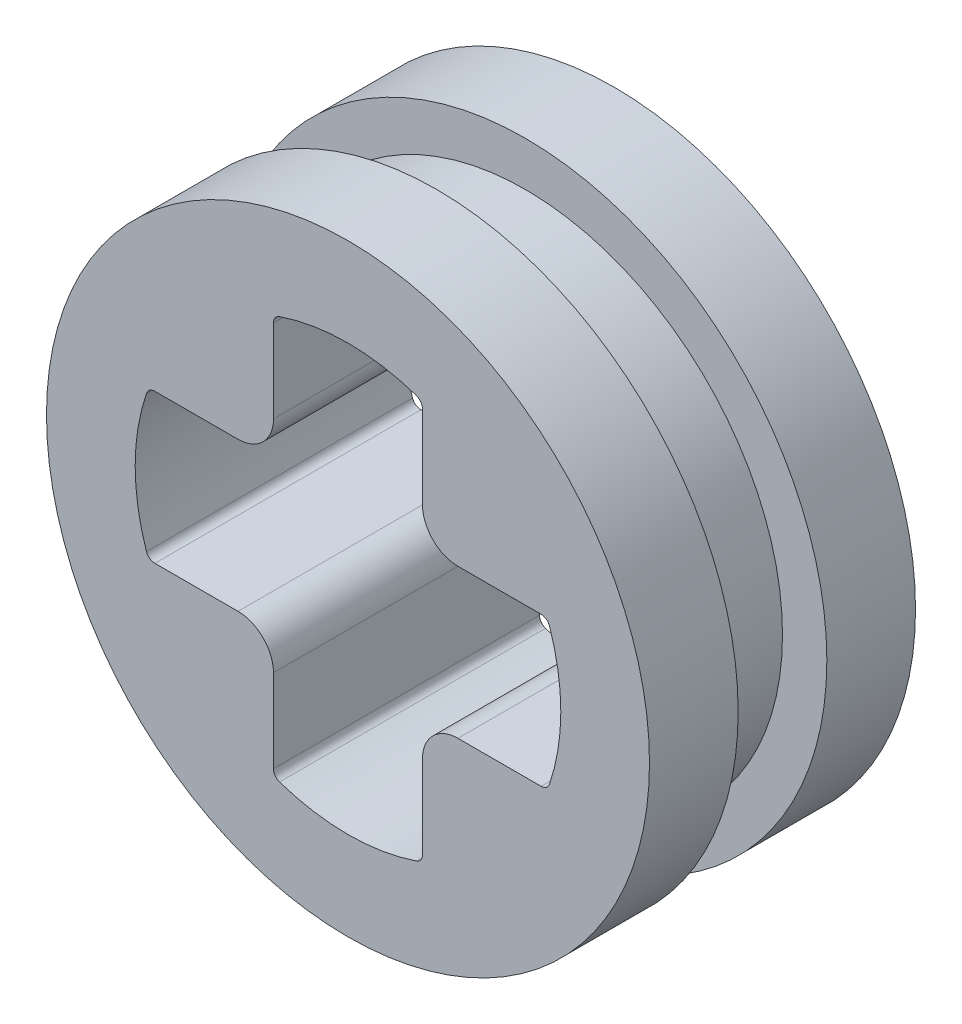
from build123d import *

# Parameters (mm, degrees)
SKETCH1_R           = 3.4
BOSS_EXTRUDE1_DEPTH = 1
SKETCH2_R           = 2.9
BOSS_EXTRUDE2_DEPTH = 1
CUT_EXTRUDE1_DEPTH  = 6.667450926
FILLET1_R           = 0.4
FILLET2_R           = 0.4
FILLET3_R           = 0.4
FILLET4_R           = 0.4
FILLET5_R           = 0.1
FILLET6_R           = 0.1
FILLET7_R           = 0.1
FILLET8_R           = 0.1
FILLET9_R           = 0.1
FILLET10_R          = 0.1
FILLET11_R          = 0.1
FILLET12_R          = 0.1


with BuildPart() as part:
    # Sketch1 → Boss-Extrude1 (new body)
    with BuildSketch(Plane.XY):
        Circle(SKETCH1_R)
    boss_extrude1 = extrude(amount=BOSS_EXTRUDE1_DEPTH)

    # Sketch2 → Boss-Extrude2 (add)
    with BuildSketch(Plane.XY.offset(1)):
        Circle(SKETCH2_R)
    extrude(amount=BOSS_EXTRUDE2_DEPTH)

    # Mirror3: Boss-Extrude1 across plane
    add(boss_extrude1.mirror(Plane.XY.offset(1.5)))

    # Sketch3 → Cut-Extrude1 (cut, through all)
    with BuildSketch(Plane(origin=(0, 0, 0), x_dir=(-1, 0, 0), z_dir=(0, 0, -1))):
        with BuildLine():
            Line((0.84, -0.84), (0.84, -2.248199279))
            ThreePointArc((0.84, -2.248199279), (0, -2.4), (-0.84, -2.248199279))
            Line((-0.84, -2.248199279), (-0.84, -0.84))
            Line((-0.84, -0.84), (-2.248199279, -0.84))
            ThreePointArc((-2.248199279, -0.84), (-2.4, 0), (-2.248199279, 0.84))
            Line((-2.248199279, 0.84), (-0.84, 0.84))
            Line((-0.84, 0.84), (-0.84, 2.248199279))
            ThreePointArc((-0.84, 2.248199279), (0, 2.4), (0.84, 2.248199279))
            Line((0.84, 2.248199279), (0.84, 0.84))
            Line((0.84, 0.84), (2.248199279, 0.84))
            ThreePointArc((2.248199279, 0.84), (2.4, 0), (2.248199279, -0.84))
            Line((2.248199279, -0.84), (0.84, -0.84))
        make_face()
    extrude(amount=-CUT_EXTRUDE1_DEPTH, mode=Mode.SUBTRACT)

    # Fillet1
    fillet1_edges = [part.edges().sort_by_distance(p)[0] for p in [
        (-0.84, 0.84, 1.5),
    ]]
    fillet(fillet1_edges, radius=FILLET1_R)

    # Fillet2
    fillet2_edges = [part.edges().sort_by_distance(p)[0] for p in [
        (0.84, 0.84, 1.5),
    ]]
    fillet(fillet2_edges, radius=FILLET2_R)

    # Fillet3
    fillet3_edges = [part.edges().sort_by_distance(p)[0] for p in [
        (0.84, -0.84, 1.5),
    ]]
    fillet(fillet3_edges, radius=FILLET3_R)

    # Fillet4
    fillet4_edges = [part.edges().sort_by_distance(p)[0] for p in [
        (-0.84, -0.84, 1.5),
    ]]
    fillet(fillet4_edges, radius=FILLET4_R)

    # Fillet5
    fillet5_edges = [part.edges().sort_by_distance(p)[0] for p in [
        (0.84, -2.248199279, 1.5),
    ]]
    fillet(fillet5_edges, radius=FILLET5_R)

    # Fillet6
    fillet6_edges = [part.edges().sort_by_distance(p)[0] for p in [
        (-0.84, -2.248199279, 1.5),
    ]]
    fillet(fillet6_edges, radius=FILLET6_R)

    # Fillet7
    fillet7_edges = [part.edges().sort_by_distance(p)[0] for p in [
        (-2.248199279, 0.84, 1.5),
    ]]
    fillet(fillet7_edges, radius=FILLET7_R)

    # Fillet8
    fillet8_edges = [part.edges().sort_by_distance(p)[0] for p in [
        (-2.248199279, -0.84, 1.5),
    ]]
    fillet(fillet8_edges, radius=FILLET8_R)

    # Fillet9
    fillet9_edges = [part.edges().sort_by_distance(p)[0] for p in [
        (-0.84, 2.248199279, 1.5),
    ]]
    fillet(fillet9_edges, radius=FILLET9_R)

    # Fillet10
    fillet10_edges = [part.edges().sort_by_distance(p)[0] for p in [
        (0.84, 2.248199279, 1.5),
    ]]
    fillet(fillet10_edges, radius=FILLET10_R)

    # Fillet11
    fillet11_edges = [part.edges().sort_by_distance(p)[0] for p in [
        (2.248199279, 0.84, 1.5),
    ]]
    fillet(fillet11_edges, radius=FILLET11_R)

    # Fillet12
    fillet12_edges = [part.edges().sort_by_distance(p)[0] for p in [
        (2.248199279, -0.84, 1.5),
    ]]
    fillet(fillet12_edges, radius=FILLET12_R)


solid = part.part
